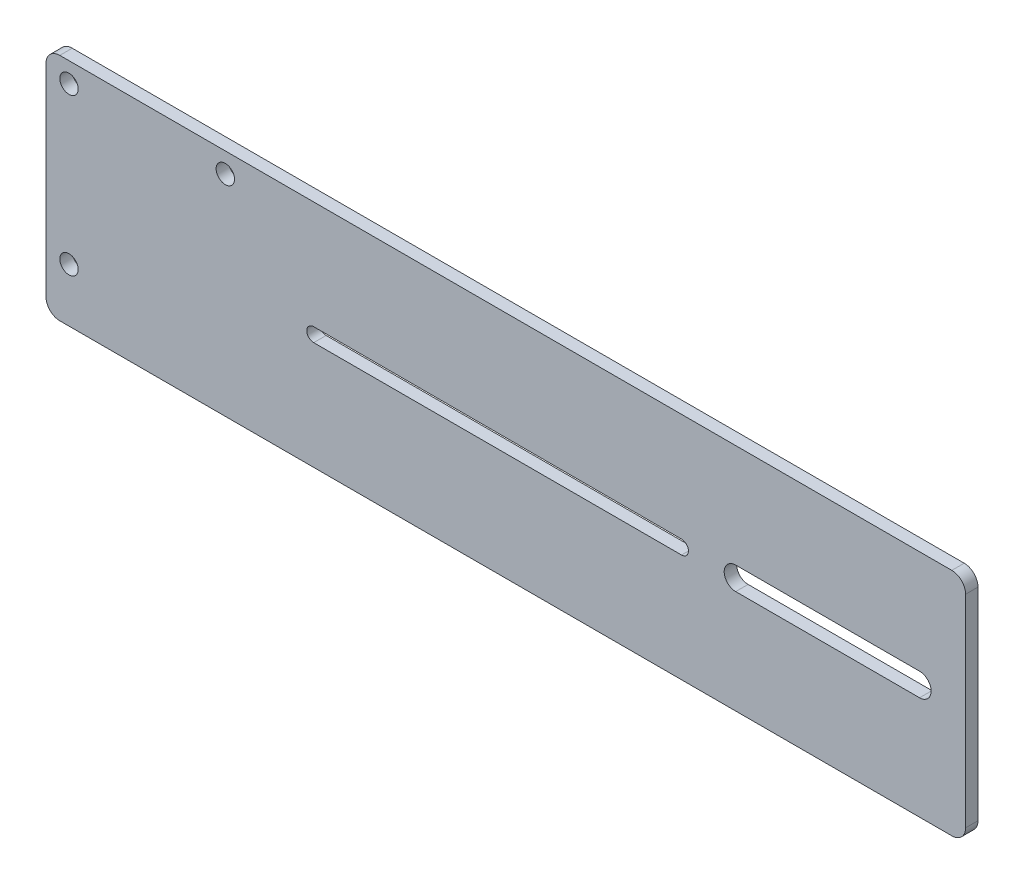
from build123d import *

# Parameters (mm, degrees)
SKETCH_1_R      = 2
EXTRUDE_1_DEPTH = 2.7


with BuildPart() as part:
    # 草图1 → 凸台-拉伸1 (new body)
    with BuildSketch(Plane.XY):
        with BuildLine():
            Line((0, 22), (0, -22))
            ThreePointArc((0, -22), (0.878679656, -24.121320344), (3, -25))
            Line((3, -25), (197, -25))
            ThreePointArc((197, -25), (199.121320344, -24.121320344), (200, -22))
            Line((200, -22), (200, 22))
            ThreePointArc((200, 22), (199.121320344, 24.121320344), (197, 25))
            Line((197, 25), (3, 25))
            ThreePointArc((3, 25), (0.878679656, 24.121320344), (0, 22))
        make_face()
        with Locations(Location((5, 20.65, 0), (0, 0, 180))):
            Circle(SKETCH_1_R, mode=Mode.SUBTRACT)
        with Locations(Location((39, 20.65, 0), (0, 0, 180))):
            Circle(SKETCH_1_R, mode=Mode.SUBTRACT)
        with Locations(Location((5, -13.35, 0), (0, 0, 180))):
            Circle(SKETCH_1_R, mode=Mode.SUBTRACT)
        with BuildLine():
            Line((150, 2.5), (190, 2.5))
            ThreePointArc((190, 2.5), (192.5, 0), (190, -2.5))
            Line((190, -2.5), (150, -2.5))
            ThreePointArc((150, -2.5), (147.5, 0), (150, 2.5))
        make_face(mode=Mode.SUBTRACT)
        with BuildLine():
            Line((58.219392868, 1.5), (138.219392868, 1.5))
            ThreePointArc((138.219392868, 1.5), (139.719392868, 0), (138.219392868, -1.5))
            Line((138.219392868, -1.5), (58.219392868, -1.5))
            ThreePointArc((58.219392868, -1.5), (56.719392868, 0), (58.219392868, 1.5))
        make_face(mode=Mode.SUBTRACT)
    extrude(amount=EXTRUDE_1_DEPTH)


solid = part.part
